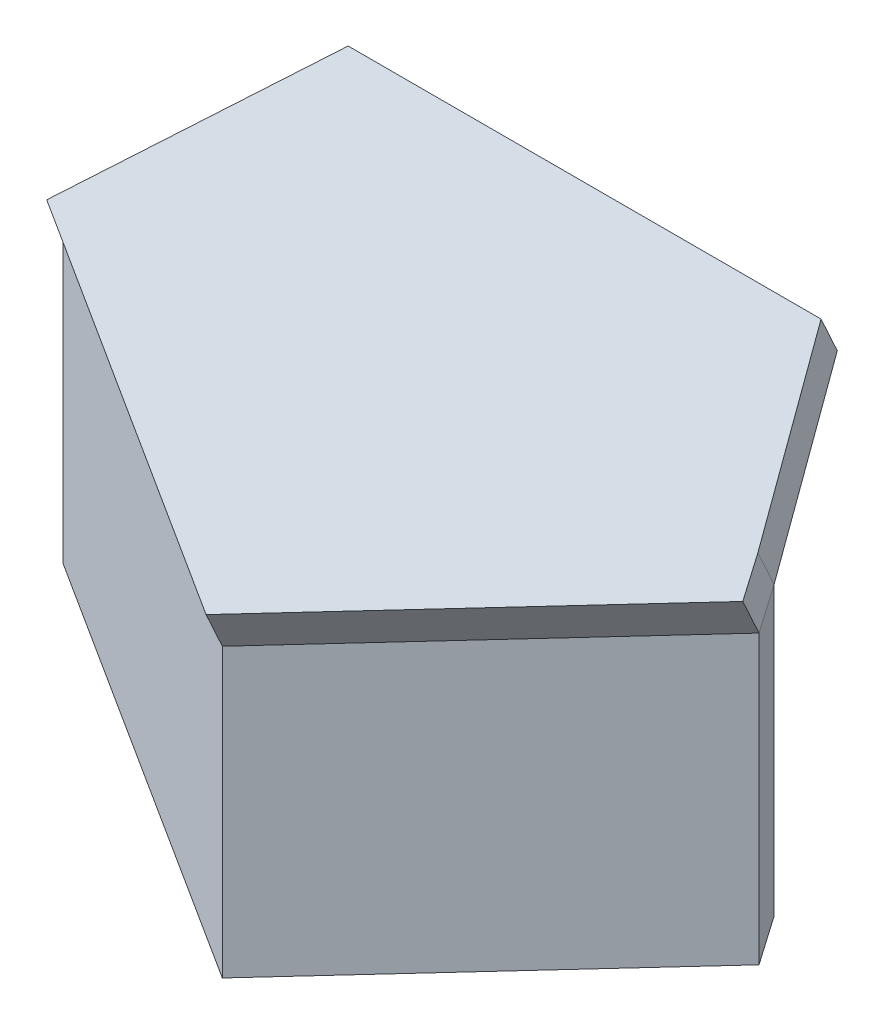
from build123d import *

# Parameters (mm, degrees)
EXTRUDE_2_DEPTH          = 100
CUT_EXTRUDE_1_DEPTH      = 143.286557619
CUT_EXTRUDE_1_DEPTH_BACK = 143.286557619
EXTRUDE_3_DEPTH          = 10


with BuildPart() as part:
    # 草图5 → 拉伸-薄壁2 (new body)
    with BuildSketch(Plane(origin=(0, 0, 0), x_dir=(1, 0, 0), z_dir=(0, 1, 0))):
        Polygon((-85.11384198, 46.497376637), (0, 0), (83.416414932, 46.497376637), (88.285235684, 37.762699512), (0.048663646, -11.421494349), (-89.908055505, 37.72152815), align=None)
    extrude(amount=EXTRUDE_2_DEPTH)

    # 草图6 → 切除-拉伸1 (cut, two sides: drawn at the far end of the back side and taken through both)
    with BuildSketch(Plane(origin=(0, 0, 0), x_dir=(0, 0, -1), z_dir=(1, 0, 0)).offset(-CUT_EXTRUDE_1_DEPTH_BACK)):
        Polygon((-11.421494349, 0), (46.497376637, 26.437958822), (46.497376637, 0), align=None)
        Polygon((46.497376637, 100), (-11.421494349, 73.562041178), (-11.421494349, 100), align=None)
    extrude(amount=CUT_EXTRUDE_1_DEPTH + CUT_EXTRUDE_1_DEPTH_BACK, mode=Mode.SUBTRACT)

    # 草图7 → 凸台-拉伸3 (add)
    with BuildSketch(Plane(origin=(0, 65.192092202, 29.757932429), x_dir=(1, 0, 0), z_dir=(0, 0.909707375853676, 0.4152499130853836))):
        Polygon((88.285235684, 74.222363952), (83.416414932, 83.823997793), (58.456022425, 129.045976045), (-62.639885843, 129.045976045), (-85.11384198, 83.823997793), (-89.908055505, 74.177106144), (0.048663646, 20.156413552), align=None)
    extrude(amount=EXTRUDE_3_DEPTH)


solid = part.part
